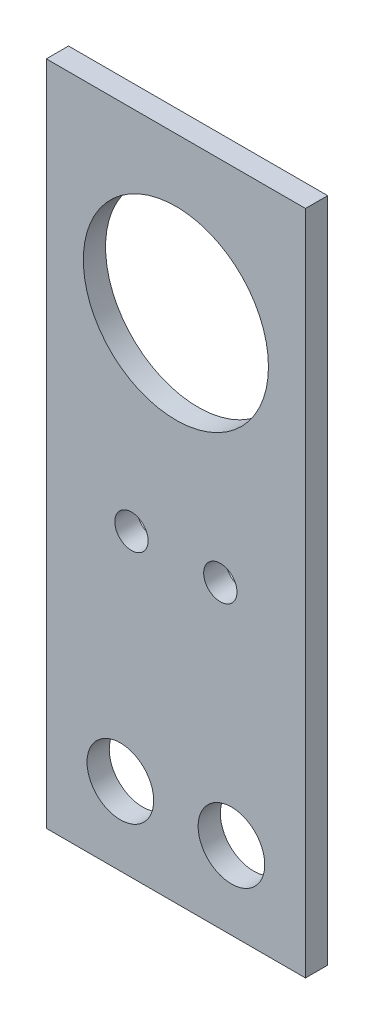
from build123d import *

# Parameters (mm, degrees)
BOSS_EXTRUDE1_DEPTH         = 10
BOSS_EXTRUDE1_DEPTH_BACK    = 80
SKETCH1_W                   = 35
SKETCH1_H                   = 3
SKETCH2_R                   = 12.5
F_25MM_THRU_DEPTH           = 76.988008091
SKETCH3_R                   = 2.25
M4_CLEARANCE_4_5_THRU_DEPTH = 76.988008091
SKETCH4_R                   = 4.5
M8_CLEARANCE_9MM_THRU_DEPTH = 76.988008091


with BuildPart() as part:
    # Sketch1 → Boss-Extrude1 (new, two sides: drawn at the far end of the back side and taken through both)
    with BuildSketch(Plane(origin=(0, 13.434024576, 0), x_dir=(1, 0, 0), z_dir=(0, 1, 0)).offset(-BOSS_EXTRUDE1_DEPTH_BACK)):
        with Locations((-19.025994709, 171.999999999)):
            Rectangle(SKETCH1_W, SKETCH1_H)
    extrude(amount=BOSS_EXTRUDE1_DEPTH + BOSS_EXTRUDE1_DEPTH_BACK)

    # Sketch2 → 25mm thru (cut, through all)
    with BuildSketch(Plane.XY.offset(-170.499999999)):
        with Locations((-19.025994709, 2.434024576)):
            Circle(SKETCH2_R)
    extrude(amount=-F_25MM_THRU_DEPTH, mode=Mode.SUBTRACT)

    # Sketch3 → M4 clearance - 4.5 -thru (cut, through all)
    with BuildSketch(Plane.XY.offset(-170.499999999)):
        with Locations((-25.025994709, -26.065975424)):
            Circle(SKETCH3_R)
        with Locations((-13.025994709, -26.065975424)):
            Circle(SKETCH3_R)
    extrude(amount=-M4_CLEARANCE_4_5_THRU_DEPTH, mode=Mode.SUBTRACT)

    # Sketch4 → M8 clearance - 9mm thru (cut, through all)
    with BuildSketch(Plane(origin=(0, 0, -173.499999999), x_dir=(-1, 0, 0), z_dir=(0, 0, -1))):
        with Locations((11.525994709, -56.065975424)):
            Circle(SKETCH4_R)
        with Locations((26.525994709, -56.065975424)):
            Circle(SKETCH4_R)
    extrude(amount=-M8_CLEARANCE_9MM_THRU_DEPTH, mode=Mode.SUBTRACT)


solid = part.part
